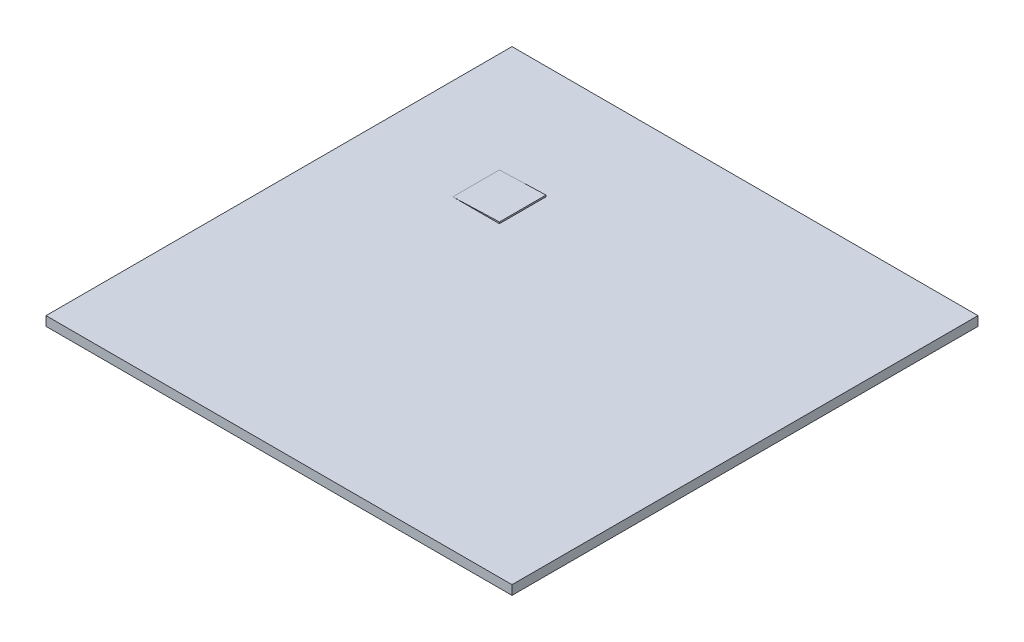
from build123d import *

# Parameters (mm, degrees)
SKETCH1_W           = 5000
SKETCH1_H           = 5000
BOSS_EXTRUDE1_DEPTH = 100
SKETCH2_W           = 500
SKETCH2_H           = 500
BOSS_EXTRUDE2_DEPTH = 50
CUT_EXTRUDE1_DEPTH  = 500


with BuildPart() as part:
    # Sketch1 → Boss-Extrude1 (new body)
    with BuildSketch(Plane(origin=(0, 0, 0), x_dir=(1, 0, 0), z_dir=(0, 1, 0))):
        Rectangle(SKETCH1_W, SKETCH1_H)
    extrude(amount=BOSS_EXTRUDE1_DEPTH)

    # Sketch2 → Boss-Extrude2 (add)
    with BuildSketch(Plane(origin=(0, 100, 0), x_dir=(1, 0, 0), z_dir=(0, 1, 0))):
        with Locations((-1171.407890826, 1036.383622217)):
            Rectangle(SKETCH2_W, SKETCH2_H)
    extrude(amount=BOSS_EXTRUDE2_DEPTH)

    # Sketch3 → Cut-Extrude1 (cut)
    with BuildSketch(Plane.XY.offset(-786.383622217)):
        Polygon((-1421.407890826, 100), (-921.407890826, 116.272607691), (-921.407890826, 150), (-1421.407890826, 150), align=None)
    extrude(amount=-CUT_EXTRUDE1_DEPTH, mode=Mode.SUBTRACT)


solid = part.part
